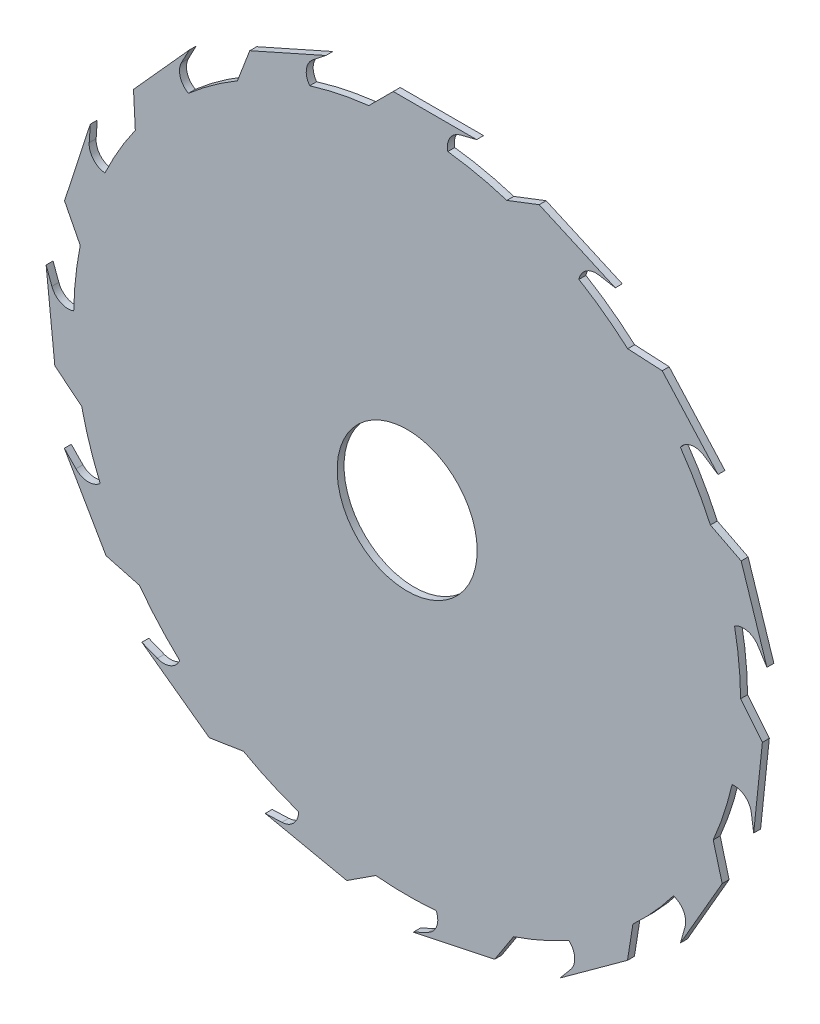
from build123d import *

# Parameters (mm, degrees)
SKETCH1_R           = 76.2
BOSS_EXTRUDE1_DEPTH = 1.5875
CUT_EXTRUDE1_REACH  = 109.775
SKETCH2_R           = 16.002
BOSS_EXTRUDE2_DEPTH = 1.5875
CIRPATTERN1_COUNT   = 15


with BuildPart() as part:
    # Sketch1 → Boss-Extrude1 (new body)
    with BuildSketch(Plane.XY):
        Circle(SKETCH1_R)
    extrude(amount=BOSS_EXTRUDE1_DEPTH)

    # Sketch2 → Cut-Extrude1 (cut, up to next)
    with BuildSketch(Plane.XY.offset(1.5875), mode=Mode.PRIVATE) as cut_extrude1_sk1:
        Circle(SKETCH2_R)
    cut_extrude1_tool1 = extrude(cut_extrude1_sk1.sketch, amount=-CUT_EXTRUDE1_REACH, mode=Mode.PRIVATE) & part.part
    add(cut_extrude1_tool1.solids().sort_by_distance((0, 0, 1.5875))[0], mode=Mode.SUBTRACT)

    # Sketch4 → Boss-Extrude2 (add)
    with BuildSketch(Plane.XY.offset(1.5875)):
        with BuildLine():
            Line((-9.525, 74.93), (-3.175, 81.28))
            Line((-3.175, 81.28), (15.875, 81.28))
            Line((15.875, 81.28), (12.1812879, 80.345874246))
            ThreePointArc((12.1812879, 80.345874246), (9.599565558, 78.252771398), (9.525, 74.93))
            Line((9.525, 74.93), (-9.525, 74.93))
        make_face()
    boss_extrude2 = extrude(amount=-BOSS_EXTRUDE2_DEPTH)

    # CirPattern1: Boss-Extrude2 ×15 about axis
    cirpattern1_axis = Axis((0, 0, 0), (0, 0, 1))
    for i in range(1, CIRPATTERN1_COUNT):
        add(boss_extrude2.rotate(cirpattern1_axis, i * 360 / CIRPATTERN1_COUNT))


solid = part.part
